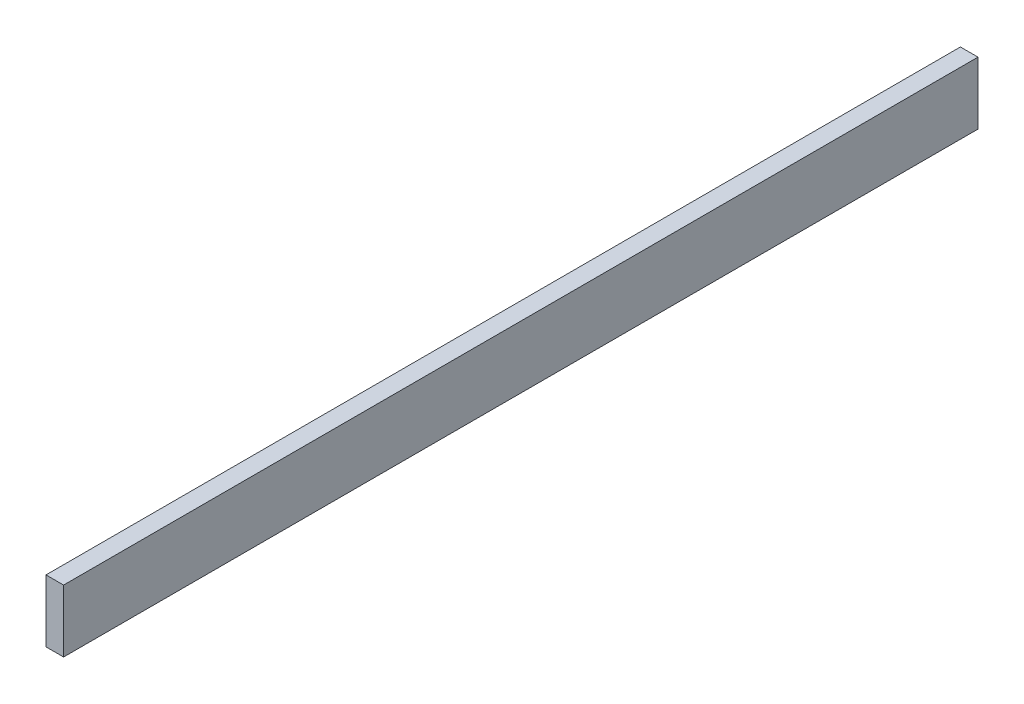
from build123d import *

# Parameters (mm, degrees)
SKETCH1_W                        = 12.7
SKETCH1_H                        = 45
CEK_1L_RAY_IC_PROFIL_SOL_1_DEPTH = 660


with BuildPart() as part:
    # Sketch1 → CEK_1L_ray_ic_profil_sol_1 (new body)
    with BuildSketch(Plane.XY):
        with Locations((6.35, 36.5)):
            Rectangle(SKETCH1_W, SKETCH1_H)
    extrude(amount=-CEK_1L_RAY_IC_PROFIL_SOL_1_DEPTH)


solid = part.part
